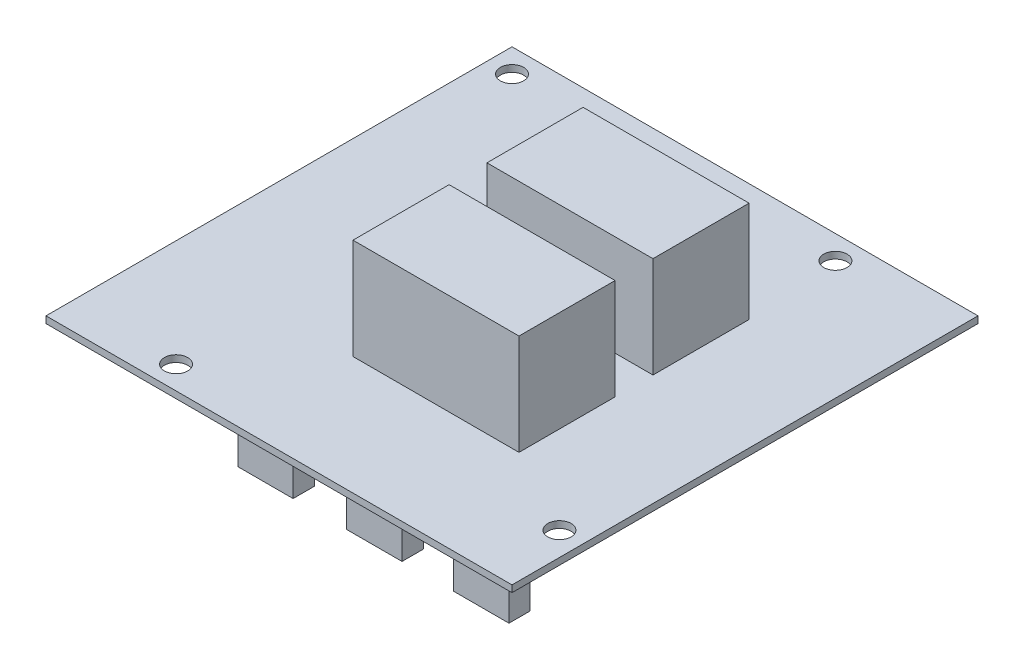
from build123d import *

# Parameters (mm, degrees)
ESQUISSE1_W        = 80
ESQUISSE1_H        = 80
ESQUISSE1_R        = 2
BOSS_EXTRU_1_DEPTH = 1.16
ESQUISSE2_W        = 28.5
ESQUISSE2_H        = 16.5
BOSS_EXTRU_2_DEPTH = 17.3
ESQUISSE3_W        = 9.5
ESQUISSE3_H        = 3.65
ESQUISSE3_W_2      = 3.65
ESQUISSE3_H_2      = 9.5
ESQUISSE3_W_3      = 5
ESQUISSE3_H_3      = 6.35
BOSS_EXTRU_3_DEPTH = 6


with BuildPart() as part:
    # Esquisse1 → Boss.-Extru.1 (new body)
    with BuildSketch(Plane(origin=(0, 0, 0), x_dir=(1, 0, 0), z_dir=(0, 1, 0))):
        Rectangle(ESQUISSE1_W, ESQUISSE1_H)
        with Locations(Location((-35.94, 35.94, 0), (0, 0, 270))):
            Circle(ESQUISSE1_R, mode=Mode.SUBTRACT)
        with Locations(Location((19.58, 35.94, 0), (0, 0, 270))):
            Circle(ESQUISSE1_R, mode=Mode.SUBTRACT)
        with Locations(Location((35.94, -27.79, 0), (0, 0, 270))):
            Circle(ESQUISSE1_R, mode=Mode.SUBTRACT)
        with Locations(Location((-21.64, -36.03, 0), (0, 0, 270))):
            Circle(ESQUISSE1_R, mode=Mode.SUBTRACT)
    extrude(amount=BOSS_EXTRU_1_DEPTH)

    # Esquisse2 → Boss.-Extru.2 (add)
    with BuildSketch(Plane(origin=(0, 1.16, 0), x_dir=(1, 0, 0), z_dir=(0, 1, 0))):
        with Locations((6.65, 11.55)):
            Rectangle(ESQUISSE2_W, ESQUISSE2_H)
        with Locations((6.65, -11.45)):
            Rectangle(ESQUISSE2_W, ESQUISSE2_H)
    extrude(amount=BOSS_EXTRU_2_DEPTH)

    # Esquisse3 → Boss.-Extru.3 (add)
    with BuildSketch(Plane.XZ):
        with Locations((33.53, 36.975)):
            Rectangle(ESQUISSE3_W, ESQUISSE3_H)
        with Locations((15.17, 36.975)):
            Rectangle(ESQUISSE3_W, ESQUISSE3_H)
        with Locations((-3.53, 36.975)):
            Rectangle(ESQUISSE3_W, ESQUISSE3_H)
        with Locations((3.275, -12.45)):
            Rectangle(ESQUISSE3_W_2, ESQUISSE3_H_2)
        with Locations((-36.975, -19.75)):
            Rectangle(ESQUISSE3_W_2, ESQUISSE3_H_2)
        with Locations((-13, -8.225)):
            Rectangle(ESQUISSE3_W_3, ESQUISSE3_H_3)
    extrude(amount=BOSS_EXTRU_3_DEPTH)


solid = part.part
